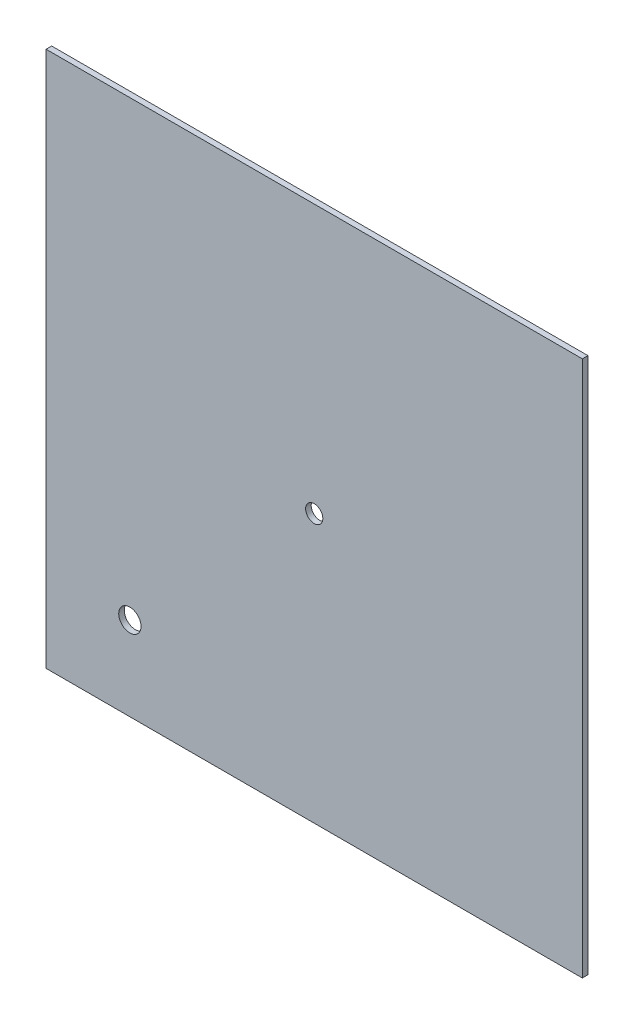
from build123d import *

# Parameters (mm, degrees)
SKETCH1_W           = 304.8
SKETCH1_H           = 304.8
SKETCH1_R           = 4.8895
BOSS_EXTRUDE1_DEPTH = 3.175
SKETCH2_R           = 6.35
CUT_EXTRUDE1_DEPTH  = 7.62


with BuildPart() as part:
    # Sketch1 → Boss-Extrude1 (new body)
    with BuildSketch(Plane.XY):
        Rectangle(SKETCH1_W, SKETCH1_H)
        Circle(SKETCH1_R, mode=Mode.SUBTRACT)
    extrude(amount=BOSS_EXTRUDE1_DEPTH)

    # Sketch2 → Cut-Extrude1 (cut)
    with BuildSketch(Plane(origin=(0, 0, 0), x_dir=(-1, 0, 0), z_dir=(0, 0, -1))):
        with Locations((104.775, -104.775)):
            Circle(SKETCH2_R)
    extrude(amount=-CUT_EXTRUDE1_DEPTH, mode=Mode.SUBTRACT)


solid = part.part
